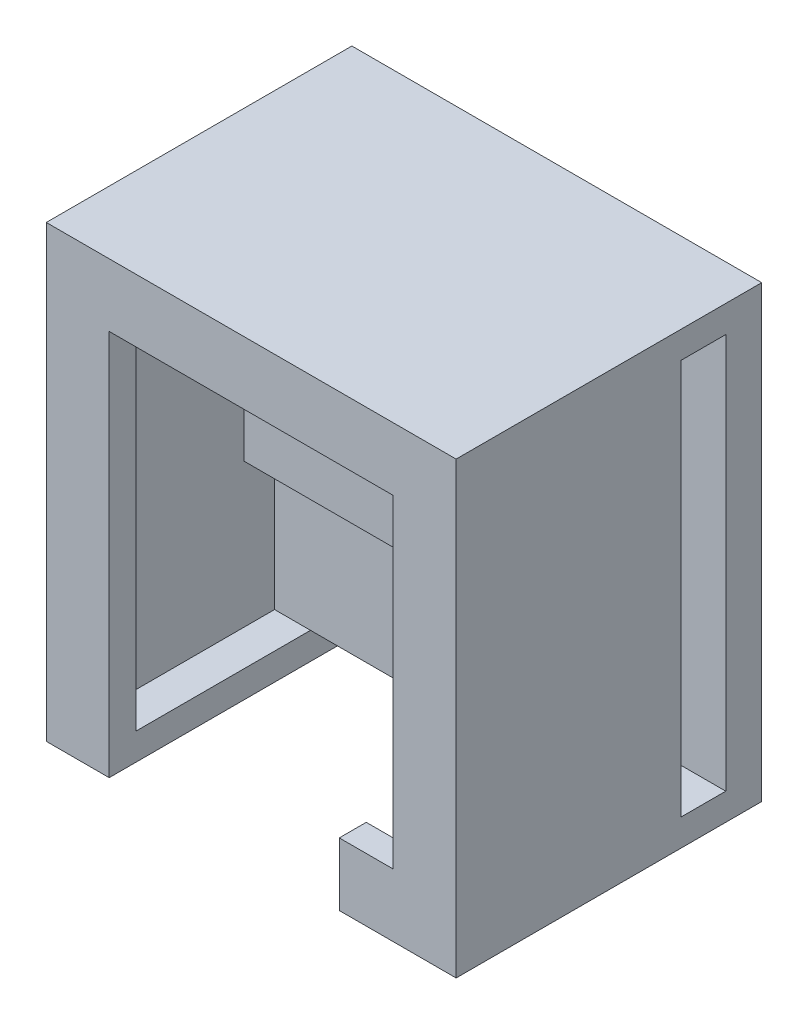
from build123d import *

# Parameters (mm, degrees)
CROQUIS1_R               = 1.5
SALIENTE_EXTRUIR1_DEPTH  = 3
SALIENTE_EXTRUIR2_DEPTH  = 8
CROQUIS3_W               = 13
CROQUIS3_H               = 1.7
CORTAR_EXTRUIR1_DEPTH    = 8
CROQUIS5_W               = 3.5
CROQUIS5_H               = 11
CROQUIS5_W_2             = 6.5
SALIENTE_EXTRUIR3_DEPTH  = 1.5
SALIENTE_EXTRUIR4_DEPTH  = 1.5
CORTAR_EXTRUIR2_START    = -12.5
CORTAR_EXTRUIR2_DEPTH    = 3
SALIENTE_EXTRUIR10_DEPTH = 4.5
CORTAR_EXTRUIR3_START    = -22.8
CROQUIS12_W              = 2.5
CROQUIS12_H              = 22
CORTAR_EXTRUIR3_DEPTH    = 22.8


with BuildPart() as part:
    # Croquis1 → Saliente-Extruir1 (new body)
    with BuildSketch(Plane.XY):
        with BuildLine():
            Line((-55.603283504, 22.637490201), (-73.603283504, 19.937490201))
            ThreePointArc((-73.603283504, 19.937490201), (-74.822083019, 19.26473017), (-75.306602598, 17.959617496))
            Line((-75.306602598, 17.959617496), (-75.306602598, -5.318007663))
            Line((-75.306602598, -5.318007663), (-35.306602598, -5.318007663))
            Line((-35.306602598, -5.318007663), (-35.306602598, 17.959617496))
            ThreePointArc((-35.306602598, 17.959617496), (-35.791122177, 19.26473017), (-37.009921692, 19.937490201))
            Line((-37.009921692, 19.937490201), (-55.009921692, 22.637490201))
            ThreePointArc((-55.009921692, 22.637490201), (-55.306602598, 22.659617496), (-55.603283504, 22.637490201))
        make_face()
        with Locations((-71.306602598, 15.681992337)):
            Circle(CROQUIS1_R, mode=Mode.SUBTRACT)
        with Locations((-39.306602598, 15.681992337)):
            Circle(CROQUIS1_R, mode=Mode.SUBTRACT)
    extrude(amount=SALIENTE_EXTRUIR1_DEPTH)

    # Croquis2 → Saliente-Extruir2 (add)
    with BuildSketch(Plane.XY.offset(3)):
        Polygon((-66.706602598, -5.318007663), (-65.206602598, -5.318007663), (-65.206602598, 16.681992337), (-45.406602598, 16.681992337), (-45.406602598, -5.318007663), (-43.906602598, -5.318007663), (-43.906602598, 18.181992337), (-66.706602598, 18.181992337), align=None)
    extrude(amount=SALIENTE_EXTRUIR2_DEPTH)

    # Croquis3 → Cortar-Extruir1 (cut)
    with BuildSketch(Plane.XZ.offset(5.318007663)):
        with Locations((-58.706602598, 2.15)):
            Rectangle(CROQUIS3_W, CROQUIS3_H)
    extrude(amount=-CORTAR_EXTRUIR1_DEPTH, mode=Mode.SUBTRACT)

    # Croquis5 → Saliente-Extruir3 (add)
    with BuildSketch(Plane.XZ.offset(5.318007663)):
        with Locations((-64.956602598, 5.5)):
            Rectangle(CROQUIS5_W, CROQUIS5_H)
        with Locations((-47.156602598, 5.5)):
            Rectangle(CROQUIS5_W_2, CROQUIS5_H)
    extrude(amount=SALIENTE_EXTRUIR3_DEPTH)

    # Croquis6 → Saliente-Extruir4 (add)
    with BuildSketch(Plane.XY.offset(11)):
        Polygon((-63.206602598, -5.318007663), (-63.206602598, -6.818007663), (-66.706602598, -6.818007663), (-66.706602598, 18.181992337), (-43.906602598, 18.181992337), (-43.906602598, -6.818007663), (-50.406602598, -6.818007663), (-50.406602598, -3.318007663), (-47.406602598, -3.318007663), (-47.406602598, 14.681992337), (-63.206602598, 14.681992337), align=None)
    extrude(amount=SALIENTE_EXTRUIR4_DEPTH)

    # Croquis7 → Cortar-Extruir2 (cut)
    with BuildSketch(Plane.XY.offset(12.5).offset(CORTAR_EXTRUIR2_START)):
        Polygon((-66.706602598, -6.818007663), (-66.706602598, 18.181992337), (-43.906602598, 18.181992337), (-43.906602598, -6.818007663), (-20.536273409, -6.818007663), (-20.536273409, 28.419792756), (-79.716652243, 28.419792756), (-79.716652243, -6.818007663), align=None)
    extrude(amount=CORTAR_EXTRUIR2_DEPTH, mode=Mode.SUBTRACT)

    # Croquis11 → Saliente-Extruir10 (add)
    with BuildSketch(Plane(origin=(0, 0, 0), x_dir=(-1, 0, 0), z_dir=(0, 0, -1))):
        Polygon((66.706602598, 18.181992337), (43.906602598, 18.181992337), (43.906602598, -6.818007663), (50.406602598, -6.818007663), (50.406602598, -5.318007663), (63.206602598, -5.318007663), (63.206602598, -6.818007663), (66.706602598, -6.818007663), align=None)
    extrude(amount=SALIENTE_EXTRUIR10_DEPTH)

    # Croquis12 → Cortar-Extruir3 (cut)
    with BuildSketch(Plane(origin=(-43.906602598, 0, 0), x_dir=(0, 0, -1), z_dir=(1, 0, 0)).offset(CORTAR_EXTRUIR3_START)):
        with Locations((1.25, 5.681992337)):
            Rectangle(CROQUIS12_W, CROQUIS12_H)
    extrude(amount=CORTAR_EXTRUIR3_DEPTH, mode=Mode.SUBTRACT)


solid = part.part
